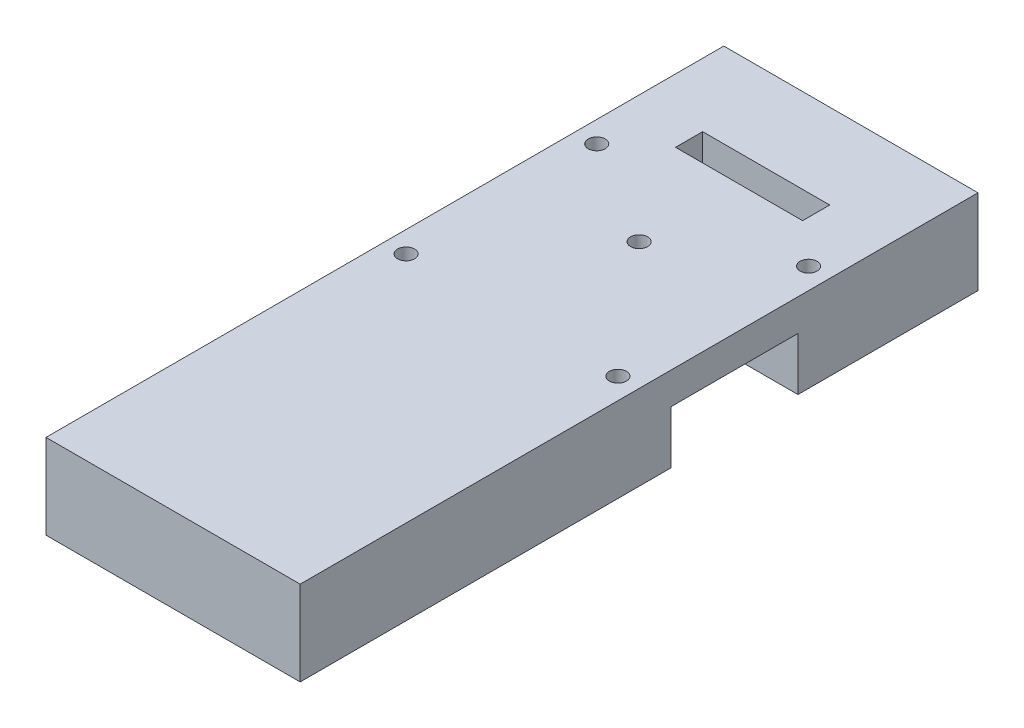
from build123d import *

# Parameters (mm, degrees)
BOSS_EXTRUDE1_DEPTH         = 12.7
BOSS_EXTRUDE1_DEPTH_BACK    = 12.7
SKETCH1_W                   = 76.2
SKETCH1_H                   = 203.2
SKETCH2_R                   = 4.7625
CUT_EXTRUDE1_DEPTH          = 25.4
CUT_EXTRUDE2_DEPTH          = 15.875
SKETCH5_W                   = 38.1
SKETCH5_H                   = 8.128
CUT_EXTRUDE4_DEPTH          = 110.249530891
F_1_4_20_TAPPED_HOLE1_D     = 5.1054
F_1_4_20_TAPPED_HOLE1_DEPTH = 19.05
F_1_4_20_TAPPED_HOLE1_TIP   = 1.533816902
SKETCH9_R                   = 2.5527
CUT_EXTRUDE5_DEPTH          = 112.44204772


with BuildPart() as part:
    # Sketch1 → Boss-Extrude1 (new, two sides: drawn at the far end of the back side and taken through both)
    with BuildSketch(Plane(origin=(0, 0, 0), x_dir=(1, 0, 0), z_dir=(0, 1, 0)).offset(-BOSS_EXTRUDE1_DEPTH_BACK)):
        Rectangle(SKETCH1_W, SKETCH1_H)
    extrude(amount=BOSS_EXTRUDE1_DEPTH + BOSS_EXTRUDE1_DEPTH_BACK)

    # Sketch2 → Cut-Extrude1 (cut)
    with BuildSketch(Plane(origin=(0, 0, -101.6), x_dir=(-1, 0, 0), z_dir=(0, 0, -1))):
        with Locations((0, -12.7)):
            Circle(SKETCH2_R)
    extrude(amount=-CUT_EXTRUDE1_DEPTH, mode=Mode.SUBTRACT)

    # Sketch3 → Cut-Extrude2 (cut)
    with BuildSketch(Plane(origin=(0, -12.7, 0), x_dir=(-1, 0, 0), z_dir=(0, -1, 0))):
        with BuildLine():
            Line((-19.05, -96.8375), (19.05, -96.8375))
            ThreePointArc((19.05, -96.8375), (23.540128061, -94.977628061), (25.4, -90.4875))
            Line((25.4, -90.4875), (25.4, 9.525))
            Line((25.4, 9.525), (44.45, 9.525))
            Line((44.45, 9.525), (44.45, 47.625))
            Line((44.45, 47.625), (-44.45, 47.625))
            Line((-44.45, 47.625), (-44.45, 9.525))
            Line((-44.45, 9.525), (-25.4, 9.525))
            Line((-25.4, 9.525), (-25.4, -90.4875))
            ThreePointArc((-25.4, -90.4875), (-23.540128061, -94.977628061), (-19.05, -96.8375))
        make_face()
        with BuildLine():
            Line((-22.225, 76.2), (22.225, 76.2))
            ThreePointArc((22.225, 76.2), (24.47006403, 75.27006403), (25.4, 73.025))
            Line((25.4, 73.025), (25.4, 71.247))
            ThreePointArc((25.4, 71.247), (24.47006403, 69.00193597), (22.225, 68.072))
            Line((22.225, 68.072), (-22.225, 68.072))
            ThreePointArc((-22.225, 68.072), (-24.47006403, 69.00193597), (-25.4, 71.247))
            Line((-25.4, 71.247), (-25.4, 73.025))
            ThreePointArc((-25.4, 73.025), (-24.47006403, 75.27006403), (-22.225, 76.2))
        make_face()
    extrude(amount=-CUT_EXTRUDE2_DEPTH, mode=Mode.SUBTRACT)

    # Sketch5 → Cut-Extrude4 (cut, through all)
    with BuildSketch(Plane(origin=(0, 0, 0), x_dir=(1, 0, 0), z_dir=(0, 1, 0))):
        with Locations((0, 72.136)):
            Rectangle(SKETCH5_W, SKETCH5_H)
    extrude(amount=CUT_EXTRUDE4_DEPTH, mode=Mode.SUBTRACT)

    # 1/4-20 Tapped Hole1
    with Locations(Plane(origin=(-11.034450397, 12.7, 14.547513529), x_dir=(-1, 0, 0), z_dir=(0, 1, 0))):
        with Locations((-11.034450397, -52.647513529)):
            Hole(F_1_4_20_TAPPED_HOLE1_D / 2, depth=F_1_4_20_TAPPED_HOLE1_DEPTH)
            with Locations((0, 0, -(F_1_4_20_TAPPED_HOLE1_DEPTH + F_1_4_20_TAPPED_HOLE1_TIP / 2))):  # 118° drill point
                Cone(0, F_1_4_20_TAPPED_HOLE1_D / 2, F_1_4_20_TAPPED_HOLE1_TIP, mode=Mode.SUBTRACT)

    # Sketch9 → Cut-Extrude5 (cut, through all)
    with BuildSketch(Plane(origin=(0, -12.7, 0), x_dir=(-1, 0, 0), z_dir=(0, -1, 0))):
        with Locations((31.75, 57.15)):
            Circle(SKETCH9_R)
        with Locations((31.75, 0)):
            Circle(SKETCH9_R)
        with Locations((-31.75, 0)):
            Circle(SKETCH9_R)
        with Locations((-31.75, 57.15)):
            Circle(SKETCH9_R)
    extrude(amount=-CUT_EXTRUDE5_DEPTH, mode=Mode.SUBTRACT)


solid = part.part
